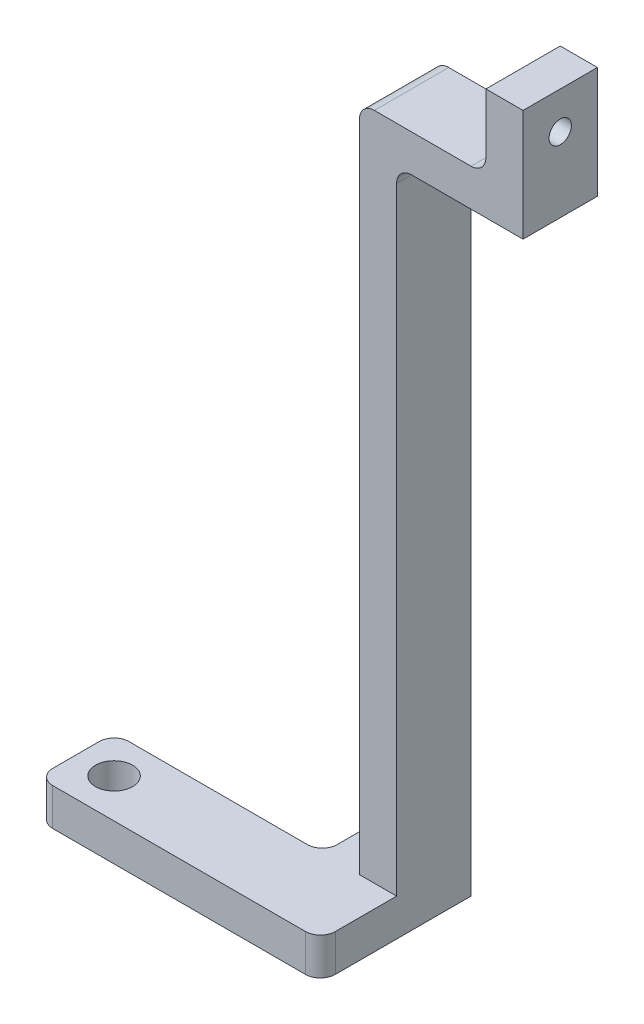
from build123d import *

# Parameters (mm, degrees)
BOSS_EXTRUDE1_DEPTH    = 7
SKETCH2_W              = 5
SKETCH2_H              = 10
BOSS_EXTRUDE2_DEPTH    = 95
SKETCH15_R             = 3.5
CUT_EXTRUDE3_DEPTH     = 7
CIRPATTERN1_COUNT      = 8
SKETCH18_W             = 10
SKETCH18_H             = 5
BOSS_EXTRUDE3_DEPTH    = 34
BOSS_EXTRUDE4_DEPTH    = 10
FILLET1_R              = 2
FILLET2_R              = 2
LPATTERN2_COUNT        = 10
LPATTERN2_PITCH        = 8
FILLET1_OF_LPATTERN2_R = 2
SKETCH20_R             = 2.5
CUT_EXTRUDE4_DEPTH     = 10
CIRPATTERN2_COUNT      = 4
SKETCH21_W             = 135.948856065
SKETCH21_H             = 109.776083996
CUT_EXTRUDE5_DEPTH     = 61.740758688
BOSS_EXTRUDE5_START    = 5
SKETCH22_R             = 2.5
BOSS_EXTRUDE5_DEPTH    = 5
CUT_EXTRUDE6_START     = -10
CUT_EXTRUDE6_DEPTH     = 10
SKETCH24_W             = 6
SKETCH24_H             = 7
CUT_EXTRUDE7_DEPTH     = 1
SKETCH25_W             = 6
SKETCH25_H             = 7
CUT_EXTRUDE8_DEPTH     = 1
SKETCH26_W             = 10
SKETCH26_H             = 5
BOSS_EXTRUDE6_DEPTH    = 5
SKETCH27_W             = 5
SKETCH27_H             = 10
BOSS_EXTRUDE7_DEPTH    = 10
SKETCH29_R             = 1.5
CUT_EXTRUDE9_DEPTH     = 5
FILLET3_R              = 2


with BuildPart() as part:
    # Sketch1 → Boss-Extrude1 (new body)
    with BuildSketch(Plane(origin=(0, 0, 0), x_dir=(1, 0, 0), z_dir=(0, 1, 0))):
        with BuildLine():
            Line((-8, 56.940758688), (-8, 59.740758688))
            ThreePointArc((-8, 59.740758688), (-7.414213562, 61.154972251), (-6, 61.740758688))
            Line((-6, 61.740758688), (6, 61.740758688))
            ThreePointArc((6, 61.740758688), (7.414213562, 61.154972251), (8, 59.740758688))
            Line((8, 59.740758688), (8, 56.940758688))
            ThreePointArc((8, 56.940758688), (22.004297361, 53.123073119), (34.606342345, 45.920050844))
            Line((34.606342345, 45.920050844), (36.586241332, 47.899949831))
            ThreePointArc((36.586241332, 47.899949831), (38.000454895, 48.485736269), (39.414668457, 47.899949831))
            Line((39.414668457, 47.899949831), (47.899949831, 39.414668457))
            ThreePointArc((47.899949831, 39.414668457), (48.485736269, 38.000454895), (47.899949831, 36.586241332))
            Line((47.899949831, 36.586241332), (45.920050844, 34.606342345))
            ThreePointArc((45.920050844, 34.606342345), (53.123073119, 22.004297361), (56.940758688, 8))
            Line((56.940758688, 8), (59.740758688, 8))
            ThreePointArc((59.740758688, 8), (61.154972251, 7.414213562), (61.740758688, 6))
            Line((61.740758688, 6), (61.740758688, -6))
            ThreePointArc((61.740758688, -6), (61.154972251, -7.414213562), (59.740758688, -8))
            Line((59.740758688, -8), (56.940758688, -8))
            ThreePointArc((56.940758688, -8), (53.123073119, -22.004297361), (45.920050844, -34.606342345))
            Line((45.920050844, -34.606342345), (47.899949831, -36.586241332))
            ThreePointArc((47.899949831, -36.586241332), (48.485736269, -38.000454895), (47.899949831, -39.414668457))
            Line((47.899949831, -39.414668457), (39.414668457, -47.899949831))
            ThreePointArc((39.414668457, -47.899949831), (38.000454895, -48.485736269), (36.586241332, -47.899949831))
            Line((36.586241332, -47.899949831), (34.606342345, -45.920050844))
            ThreePointArc((34.606342345, -45.920050844), (22.004297361, -53.123073119), (8, -56.940758688))
            Line((8, -56.940758688), (8, -59.740758688))
            ThreePointArc((8, -59.740758688), (7.414213562, -61.154972251), (6, -61.740758688))
            Line((6, -61.740758688), (-6, -61.740758688))
            ThreePointArc((-6, -61.740758688), (-7.414213562, -61.154972251), (-8, -59.740758688))
            Line((-8, -59.740758688), (-8, -56.940758688))
            ThreePointArc((-8, -56.940758688), (-22.004297361, -53.123073119), (-34.606342345, -45.920050844))
            Line((-34.606342345, -45.920050844), (-36.586241332, -47.899949831))
            ThreePointArc((-36.586241332, -47.899949831), (-38.000454895, -48.485736269), (-39.414668457, -47.899949831))
            Line((-39.414668457, -47.899949831), (-47.899949831, -39.414668457))
            ThreePointArc((-47.899949831, -39.414668457), (-48.485736269, -38.000454895), (-47.899949831, -36.586241332))
            Line((-47.899949831, -36.586241332), (-45.920050844, -34.606342345))
            ThreePointArc((-45.920050844, -34.606342345), (-53.123073119, -22.004297361), (-56.940758688, -8))
            Line((-56.940758688, -8), (-59.740758688, -8))
            ThreePointArc((-59.740758688, -8), (-61.154972251, -7.414213562), (-61.740758688, -6))
            Line((-61.740758688, -6), (-61.740758688, 6))
            ThreePointArc((-61.740758688, 6), (-61.154972251, 7.414213562), (-59.740758688, 8))
            Line((-59.740758688, 8), (-56.940758688, 8))
            ThreePointArc((-56.940758688, 8), (-53.123073119, 22.004297361), (-45.920050844, 34.606342345))
            Line((-45.920050844, 34.606342345), (-47.899949831, 36.586241332))
            ThreePointArc((-47.899949831, 36.586241332), (-48.485736269, 38.000454895), (-47.899949831, 39.414668457))
            Line((-47.899949831, 39.414668457), (-39.414668457, 47.899949831))
            ThreePointArc((-39.414668457, 47.899949831), (-38.000454895, 48.485736269), (-36.586241332, 47.899949831))
            Line((-36.586241332, 47.899949831), (-34.606342345, 45.920050844))
            ThreePointArc((-34.606342345, 45.920050844), (-22.004297361, 53.123073119), (-8, 56.940758688))
        make_face()
    extrude(amount=BOSS_EXTRUDE1_DEPTH)

    # Sketch2 → Boss-Extrude2 (add)
    with BuildSketch(Plane(origin=(0, 7, 0), x_dir=(1, 0, 0), z_dir=(0, 1, 0))):
        with Locations((19.5, 10)):
            Rectangle(SKETCH2_W, SKETCH2_H)
        with Locations((-19.5, 10)):
            Rectangle(SKETCH2_W, SKETCH2_H)
    extrude(amount=BOSS_EXTRUDE2_DEPTH)

    # Sketch15 → Cut-Extrude3 (cut)
    with BuildSketch(Plane.XZ):
        with Locations(Location((0, 0, 0), (0, 0, 270))):
            Circle(SKETCH15_R)
    extrude(amount=-CUT_EXTRUDE3_DEPTH, mode=Mode.SUBTRACT)

    # Sketch16 → Cut-Loft2 section 0
    with BuildSketch(Plane.XZ):
        with BuildLine():
            Line((-6, 59.8), (6, 59.8))
            Line((6, 59.8), (6, 57.5))
            Line((6, 57.5), (-6, 57.5))
            Line((-6, 57.5), (-6, 59.8))
        make_face()
    # Sketch17 → Cut-Loft2 section 1
    with BuildSketch(Plane(origin=(0, 7, 0), x_dir=(1, 0, 0), z_dir=(0, 1, 0))):
        with BuildLine():
            Line((-6, -57.5), (6, -57.5))
            Line((6, -57.5), (6, -60.5))
            Line((6, -60.5), (-6, -60.5))
            Line((-6, -60.5), (-6, -57.5))
        make_face()
    cut_loft2 = loft(mode=Mode.SUBTRACT)

    # CirPattern1: Cut-Loft2 ×8 about axis
    cirpattern1_axis = Axis((0, 0, 0), (0, 1, 0))
    for i in range(1, CIRPATTERN1_COUNT):
        add(cut_loft2.rotate(cirpattern1_axis, i * 360 / CIRPATTERN1_COUNT), mode=Mode.SUBTRACT)

    # Sketch18 → Boss-Extrude3 (add)
    with BuildSketch(Plane(origin=(-17, 0, 0), x_dir=(0, 0, -1), z_dir=(1, 0, 0))):
        with Locations((10, 99.5)):
            Rectangle(SKETCH18_W, SKETCH18_H)
    extrude(amount=BOSS_EXTRUDE3_DEPTH)

    # Sketch19 → Boss-Extrude4 (add)
    with BuildSketch(Plane(origin=(0, 0, -15), x_dir=(-1, 0, 0), z_dir=(0, 0, -1))):
        with BuildLine():
            Line((-17, 93), (-11.04472309, 92.26878394))
            ThreePointArc((-11.04472309, 92.26878394), (-9.922197884, 91), (-11.04472309, 89.73121606))
            Line((-11.04472309, 89.73121606), (-17, 89))
            Line((-17, 89), (-17, 93))
        make_face()
    boss_extrude4 = extrude(amount=-BOSS_EXTRUDE4_DEPTH)

    # Fillet1
    fillet1_edges = [part.edges().sort_by_distance(p)[0] for p in [
        (17, 89, -10),
        (17, 93, -10),
    ]]
    fillet(fillet1_edges, radius=FILLET1_R)

    # Fillet2
    fillet2_edges = [part.edges().sort_by_distance(p)[0] for p in [
        (22, 102, -10),
        (-22, 102, -10),
        (-17, 97, -10),
        (17, 97, -10),
    ]]
    fillet(fillet2_edges, radius=FILLET2_R)

    # LPattern2: Boss-Extrude4 ×10
    with Locations(*[(0, -i * LPATTERN2_PITCH, 0) for i in range(1, LPATTERN2_COUNT)]):
        add(boss_extrude4)

    # Fillet1 of LPattern2
    fillet1_of_lpattern2_edges = [part.edges().sort_by_distance(p)[0] for p in [
        (17, 81, -10),
        (17, 85, -10),
        (17, 73, -10),
        (17, 77, -10),
        (17, 65, -10),
        (17, 69, -10),
        (17, 57, -10),
        (17, 61, -10),
        (17, 49, -10),
        (17, 53, -10),
        (17, 41, -10),
        (17, 45, -10),
        (17, 33, -10),
        (17, 37, -10),
        (17, 25, -10),
        (17, 29, -10),
        (17, 17, -10),
        (17, 21, -10),
    ]]
    fillet(fillet1_of_lpattern2_edges, radius=FILLET1_OF_LPATTERN2_R)

    # Sketch20 → Cut-Extrude4 (cut)
    with BuildSketch(Plane(origin=(0, 7, 0), x_dir=(1, 0, 0), z_dir=(0, 1, 0))):
        with Locations(Location((0, 50, 0), (0, 0, 270))):
            Circle(SKETCH20_R)
    cut_extrude4 = extrude(amount=-CUT_EXTRUDE4_DEPTH, mode=Mode.SUBTRACT)

    # CirPattern2: Cut-Extrude4 ×4 about axis
    cirpattern2_axis = Axis((0, 0, 0), (0, 1, 0))
    for i in range(1, CIRPATTERN2_COUNT):
        add(cut_extrude4.rotate(cirpattern2_axis, i * 360 / CIRPATTERN2_COUNT), mode=Mode.SUBTRACT)

    # Sketch21 → Cut-Extrude5 (cut)
    with BuildSketch(Plane(origin=(0, 0, 0), x_dir=(0, 0, -1), z_dir=(1, 0, 0))):
        with Locations((-0.523455441, 54.888041998)):
            Rectangle(SKETCH21_W, SKETCH21_H)
    extrude(amount=CUT_EXTRUDE5_DEPTH, mode=Mode.SUBTRACT)

    # Sketch22 → Boss-Extrude5 (add)
    with BuildSketch(Plane(origin=(0, 7, 0), x_dir=(1, 0, 0), z_dir=(0, 1, 0)).offset(BOSS_EXTRUDE5_START)):
        with BuildLine():
            Line((-17, 5), (-53, 5))
            ThreePointArc((-53, 5), (-54.414213562, 4.414213562), (-55, 3))
            Line((-55, 3), (-55, -3.250625366))
            ThreePointArc((-55, -3.250625366), (-54.414213562, -4.664838928), (-53, -5.250625366))
            Line((-53, -5.250625366), (-19, -5.250625366))
            ThreePointArc((-19, -5.250625366), (-17.585786438, -4.664838928), (-17, -3.250625366))
            Line((-17, -3.250625366), (-17, 5))
        make_face()
        with Locations(Location((-50, 0, 0), (0, 0, 270))):
            Circle(SKETCH22_R, mode=Mode.SUBTRACT)
    extrude(amount=-BOSS_EXTRUDE5_DEPTH)

    # Sketch23 → Cut-Extrude6 (cut)
    with BuildSketch(Plane(origin=(0, 7, 0), x_dir=(1, 0, 0), z_dir=(0, 1, 0)).offset(CUT_EXTRUDE6_START)):
        with BuildLine():
            Line((0, 60.5), (0, 61.740758688))
            Line((0, 61.740758688), (-6, 61.740758688))
            ThreePointArc((-6, 61.740758688), (-7.414213562, 61.154972251), (-8, 59.740758688))
            Line((-8, 59.740758688), (-8, 56.940758688))
            ThreePointArc((-8, 56.940758688), (-22.004297361, 53.123073119), (-34.606342345, 45.920050844))
            Line((-34.606342345, 45.920050844), (-36.586241332, 47.899949831))
            ThreePointArc((-36.586241332, 47.899949831), (-38.000454895, 48.485736269), (-39.414668457, 47.899949831))
            Line((-39.414668457, 47.899949831), (-47.899949831, 39.414668457))
            ThreePointArc((-47.899949831, 39.414668457), (-48.485736269, 38.000454895), (-47.899949831, 36.586241332))
            Line((-47.899949831, 36.586241332), (-45.920050844, 34.606342345))
            ThreePointArc((-45.920050844, 34.606342345), (-53.123073119, 22.004297361), (-56.940758688, 8))
            Line((-56.940758688, 8), (-59.740758688, 8))
            ThreePointArc((-59.740758688, 8), (-61.154972251, 7.414213562), (-61.740758688, 6))
            Line((-61.740758688, 6), (-61.740758688, -6))
            ThreePointArc((-61.740758688, -6), (-61.154972251, -7.414213562), (-59.740758688, -8))
            Line((-59.740758688, -8), (-56.940758688, -8))
            ThreePointArc((-56.940758688, -8), (-53.123073119, -22.004297361), (-45.920050844, -34.606342345))
            Line((-45.920050844, -34.606342345), (-47.899949831, -36.586241332))
            ThreePointArc((-47.899949831, -36.586241332), (-48.485736269, -38.000454895), (-47.899949831, -39.414668457))
            Line((-47.899949831, -39.414668457), (-39.414668457, -47.899949831))
            ThreePointArc((-39.414668457, -47.899949831), (-38.000454895, -48.485736269), (-36.586241332, -47.899949831))
            Line((-36.586241332, -47.899949831), (-34.606342345, -45.920050844))
            ThreePointArc((-34.606342345, -45.920050844), (-22.004297361, -53.123073119), (-8, -56.940758688))
            Line((-8, -56.940758688), (-8, -59.740758688))
            ThreePointArc((-8, -59.740758688), (-7.414213562, -61.154972251), (-6, -61.740758688))
            Line((-6, -61.740758688), (0, -61.740758688))
            Line((0, -61.740758688), (0, -60.5))
            Line((0, -60.5), (-6, -60.5))
            Line((-6, -60.5), (-6, -57.5))
            Line((-6, -57.5), (0, -57.5))
            Line((0, -57.5), (0, -52.5))
            ThreePointArc((0, -52.5), (-2.5, -50), (0, -47.5))
            Line((0, -47.5), (0, -3.5))
            ThreePointArc((0, -3.5), (-3.5, 0), (0, 3.5))
            Line((0, 3.5), (0, 47.5))
            ThreePointArc((0, 47.5), (-2.5, 50), (0, 52.5))
            Line((0, 52.5), (0, 57.5))
            Line((0, 57.5), (-6, 57.5))
            Line((-6, 57.5), (-6, 60.5))
            Line((-6, 60.5), (0, 60.5))
        make_face()
    extrude(amount=CUT_EXTRUDE6_DEPTH, mode=Mode.SUBTRACT)


with BuildPart() as cut_extrude6_piece_1:
    # of the separate pieces the step leaves, piece 1, a body of its own (cut_extrude6_pieces)
    add(part.part.solids().sort_by_distance((0, 102, -5))[0])

    # Sketch26 → Boss-Extrude6 (add)
    with BuildSketch(Plane.ZY.offset(22)):
        with Locations((-10, 9.5)):
            Rectangle(SKETCH26_W, SKETCH26_H)
    extrude(amount=BOSS_EXTRUDE6_DEPTH)

    # Sketch27 → Boss-Extrude7 (add)
    with BuildSketch(Plane(origin=(0, 102, 0), x_dir=(1, 0, 0), z_dir=(0, 1, 0))):
        with Locations((-2.5, 10)):
            Rectangle(SKETCH27_W, SKETCH27_H)
    extrude(amount=BOSS_EXTRUDE7_DEPTH)

    # Sketch29 → Cut-Extrude9 (cut)
    with BuildSketch(Plane.ZY.offset(5)):
        with Locations((-10, 107)):
            Circle(SKETCH29_R)
    extrude(amount=-CUT_EXTRUDE9_DEPTH, mode=Mode.SUBTRACT)

    # Fillet3
    fillet3_edges = [cut_extrude6_piece_1.edges().sort_by_distance(p)[0] for p in [
        (-27, 9.5, -5),
        (-27, 9.5, -15),
        (-5, 102, -10),
    ]]
    fillet(fillet3_edges, radius=FILLET3_R)


with BuildPart() as cut_extrude6_piece_2:
    # of the separate pieces the step leaves, piece 2, a body of its own (cut_extrude6_pieces)
    add(part.part.solids().sort_by_distance((-6, 0, 59.8))[0])

    # Sketch24 → Cut-Extrude7 (cut)
    with BuildSketch(Plane.XY.offset(60.5)):
        with Locations((-3, 3.5)):
            Rectangle(SKETCH24_W, SKETCH24_H)
    extrude(amount=-CUT_EXTRUDE7_DEPTH, mode=Mode.SUBTRACT)


with BuildPart() as cut_extrude6_piece_3:
    # of the separate pieces the step leaves, piece 3, a body of its own (cut_extrude6_pieces)
    add(part.part.solids().sort_by_distance((0, 7, -60.5))[0])

    # Sketch25 → Cut-Extrude8 (cut)
    with BuildSketch(Plane(origin=(0, 0, -60.5), x_dir=(-1, 0, 0), z_dir=(0, 0, -1))):
        with Locations((3, 3.5)):
            Rectangle(SKETCH25_W, SKETCH25_H)
    extrude(amount=-CUT_EXTRUDE8_DEPTH, mode=Mode.SUBTRACT)


solid = cut_extrude6_piece_1.part
